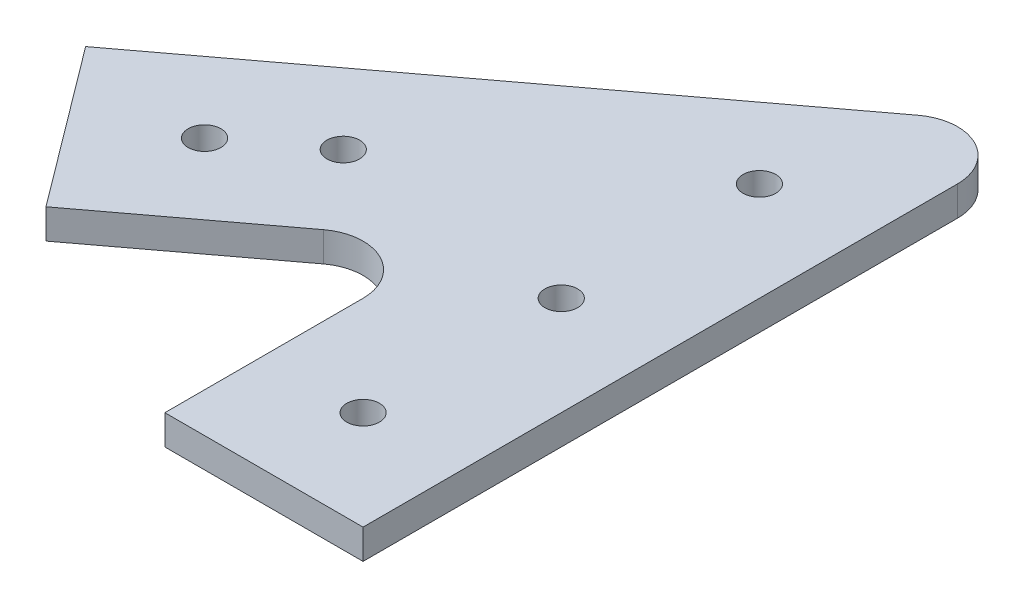
from build123d import *

# Parameters (mm, degrees)
SKETCH_1_R      = 1.649999992
SKETCH_1_R_2    = 1.649999999
SKETCH_1_R_3    = 1.65
EXTRUDE_1_DEPTH = 3
FILLET_2_R      = 5
FILLET_3_R      = 5


with BuildPart() as part:
    # 草图1 → 凸台-拉伸1 (new body)
    with BuildSketch(Plane(origin=(0, 0, 0), x_dir=(1, 0, 0), z_dir=(0, 1, 0))):
        Polygon((-28.332706405, -6.664922467), (-16.332704755, -22.664921194), (7.667293339, -4.664918716), (7.664042293, -34.664767296), (27.664042293, -34.664767296), (27.664489855, 35.332983845), (-4.33270825, 11.335080057), align=None)
        with Locations(Location((17.667491748, 15.335232704, 0), (0, 0, 270))):
            Circle(SKETCH_1_R, mode=Mode.SUBTRACT)
        with Locations(Location((17.667491748, -4.664767296, 0), (0, 0, 270))):
            Circle(SKETCH_1_R, mode=Mode.SUBTRACT)
        with Locations(Location((17.667491748, -24.664767296, 0), (0, 0, 270))):
            Circle(SKETCH_1_R, mode=Mode.SUBTRACT)
        with Locations(Location((-6.332706828, -2.664920166, 0), (0, 0, 270))):
            Circle(SKETCH_1_R_2, mode=Mode.SUBTRACT)
        with Locations(Location((-14.332706205, -8.664920997, 0), (0, 0, 270))):
            Circle(SKETCH_1_R_3, mode=Mode.SUBTRACT)
    extrude(amount=EXTRUDE_1_DEPTH)

    # 圆角2
    fillet_2_edges = [part.edges().sort_by_distance(p)[0] for p in [
        (7.667293339, 1.5, 4.664918716),
    ]]
    fillet(fillet_2_edges, radius=FILLET_2_R)

    # 圆角3
    fillet_3_edges = [part.edges().sort_by_distance(p)[0] for p in [
        (27.664489855, 1.5, -35.332983845),
    ]]
    fillet(fillet_3_edges, radius=FILLET_3_R)


solid = part.part
